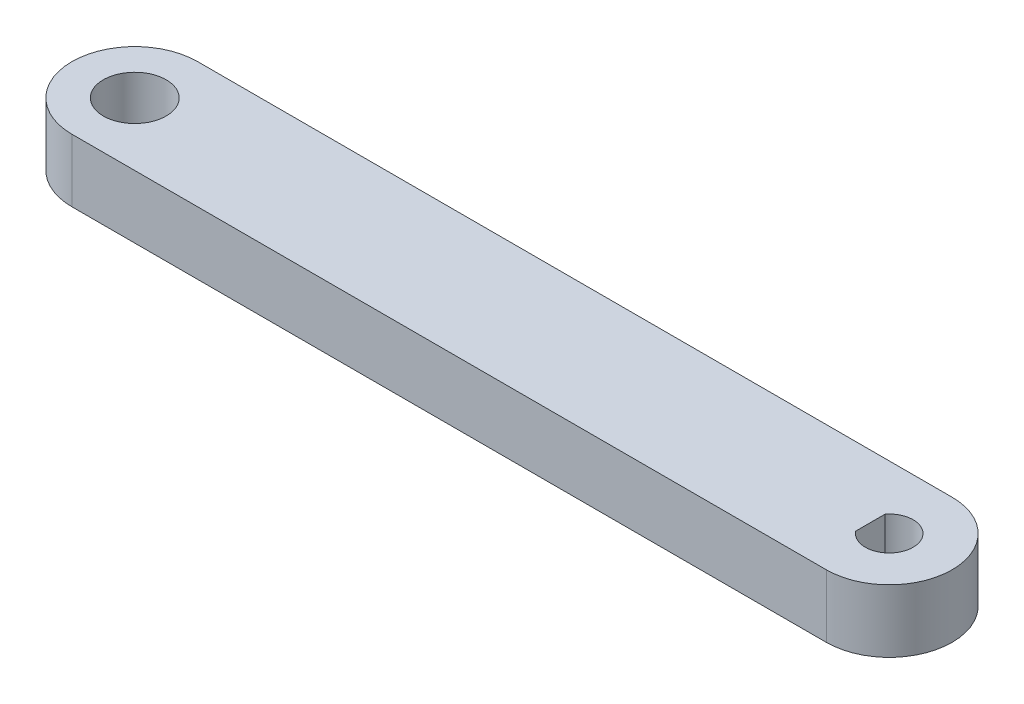
from build123d import *

# Parameters (mm, degrees)
BOSS_EXTRUDE1_DEPTH = 6.35
CUT_EXTRUDE1_DEPTH  = 84.037024874
SKETCH4_R           = 3.175
CUT_EXTRUDE3_DEPTH  = 84.037024874


with BuildPart() as part:
    # Sketch1 → Boss-Extrude1 (new body)
    with BuildSketch(Plane(origin=(0, 0, 0), x_dir=(1, 0, 0), z_dir=(0, 1, 0))):
        with BuildLine():
            Line((0, -6.35), (-76.2, -6.35))
            ThreePointArc((-76.2, -6.35), (-82.55, 0), (-76.2, 6.35))
            Line((-76.2, 6.35), (0, 6.35))
            ThreePointArc((0, 6.35), (6.35, 0), (0, -6.35))
        make_face()
    extrude(amount=BOSS_EXTRUDE1_DEPTH)

    # Sketch2 → Cut-Extrude1 (cut, through all)
    with BuildSketch(Plane(origin=(0, 6.35, 0), x_dir=(1, 0, 0), z_dir=(0, 1, 0))):
        with BuildLine():
            Line((-1.905, -1.481061781), (-1.905, 1.481061781))
            ThreePointArc((-1.905, 1.481061781), (2.413, 0), (-1.905, -1.481061781))
        make_face()
    extrude(amount=-CUT_EXTRUDE1_DEPTH, mode=Mode.SUBTRACT)

    # Sketch4 → Cut-Extrude3 (cut, through all)
    with BuildSketch(Plane(origin=(0, 6.35, 0), x_dir=(1, 0, 0), z_dir=(0, 1, 0))):
        with Locations(Location((-76.2, 0, 0), (0, 0, 270))):
            Circle(SKETCH4_R)
    extrude(amount=-CUT_EXTRUDE3_DEPTH, mode=Mode.SUBTRACT)


solid = part.part
